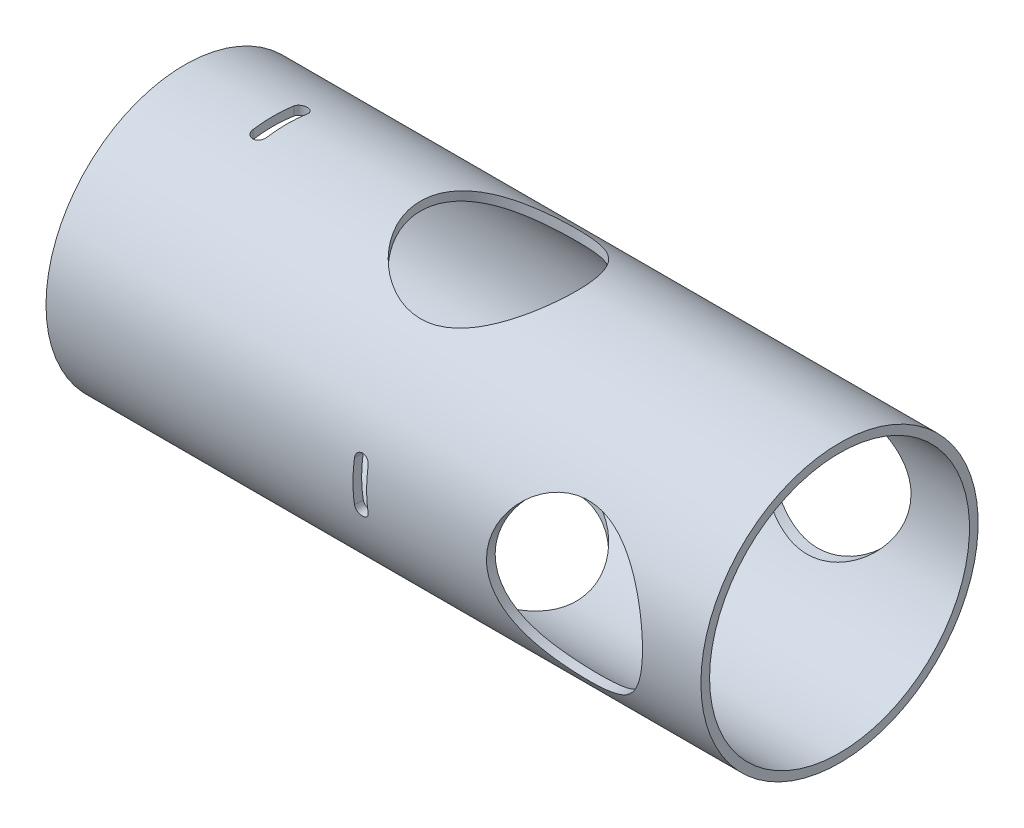
from build123d import *

# Parameters (mm, degrees)
SKETCH1_W               = 480
SKETCH1_H               = 6.35
CUT_EXTRUDE1_DEPTH      = 502.044030001
CUT_EXTRUDE1_DEPTH_BACK = 502.044030001
SKETCH2_R               = 57.15
CUT_EXTRUDE2_DEPTH      = 502.044030138
CUT_EXTRUDE2_DEPTH_BACK = 502.044030138
SKETCH3_R               = 57.15
CUT_EXTRUDE3_DEPTH      = 502.044030138
CUT_EXTRUDE3_DEPTH_BACK = 502.044030138
CUT_EXTRUDE4_DEPTH      = 502.044030138
CUT_EXTRUDE4_DEPTH_BACK = 502.044030138


with BuildPart() as part:
    # Sketch1 → Revolve1 (revolve)
    with BuildSketch(Plane(origin=(0, 0, 0), x_dir=(1, 0, 0), z_dir=(0, 1, 0)), mode=Mode.PRIVATE) as revolve1_sk:
        with Locations((240, 98.425)):
            Rectangle(SKETCH1_W, SKETCH1_H)
    revolve(revolve1_sk.sketch.rotate(Axis((78.313149083, 0, 0), (1, 0, 0)), 180), axis=Axis((78.313149083, 0, 0), (1, 0, 0)))

    # Sketch2 → Cut-Extrude1 (cut, two sides: drawn at the far end of the back side and taken through both)
    with BuildSketch(Plane.XY.offset(-CUT_EXTRUDE1_DEPTH_BACK)):
        with Locations((380, 0)):
            Circle(SKETCH2_R)
    extrude(amount=CUT_EXTRUDE1_DEPTH + CUT_EXTRUDE1_DEPTH_BACK, mode=Mode.SUBTRACT)

    # Sketch3 → Cut-Extrude2 (cut, two sides: drawn at the far end of the back side and taken through both)
    with BuildSketch(Plane(origin=(0, 0, 0), x_dir=(1, 0, 0), z_dir=(0, 1, 0)).offset(-CUT_EXTRUDE2_DEPTH_BACK)):
        with Locations(Location((230, 0, 0), (0, 0, 270))):
            Circle(SKETCH3_R)
    extrude(amount=CUT_EXTRUDE2_DEPTH + CUT_EXTRUDE2_DEPTH_BACK, mode=Mode.SUBTRACT)

    # Sketch4 → Cut-Extrude3 (cut, two sides: drawn at the far end of the back side and taken through both)
    with BuildSketch(Plane.XY.offset(-CUT_EXTRUDE3_DEPTH_BACK)):
        with BuildLine():
            Line((225, 15), (225, -15))
            ThreePointArc((225, -15), (230, -20), (235, -15))
            Line((235, -15), (235, 15))
            ThreePointArc((235, 15), (230, 20), (225, 15))
        make_face()
    extrude(amount=CUT_EXTRUDE3_DEPTH + CUT_EXTRUDE3_DEPTH_BACK, mode=Mode.SUBTRACT)

    # Sketch5 → Cut-Extrude4 (cut, two sides: drawn at the far end of the back side and taken through both)
    with BuildSketch(Plane(origin=(0, 0, 0), x_dir=(1, 0, 0), z_dir=(0, 1, 0)).offset(-CUT_EXTRUDE4_DEPTH_BACK)):
        with BuildLine():
            Line((65, -15), (65, 15))
            ThreePointArc((65, 15), (70, 20), (75, 15))
            Line((75, 15), (75, -15))
            ThreePointArc((75, -15), (70, -20), (65, -15))
        make_face()
    extrude(amount=CUT_EXTRUDE4_DEPTH + CUT_EXTRUDE4_DEPTH_BACK, mode=Mode.SUBTRACT)


solid = part.part
